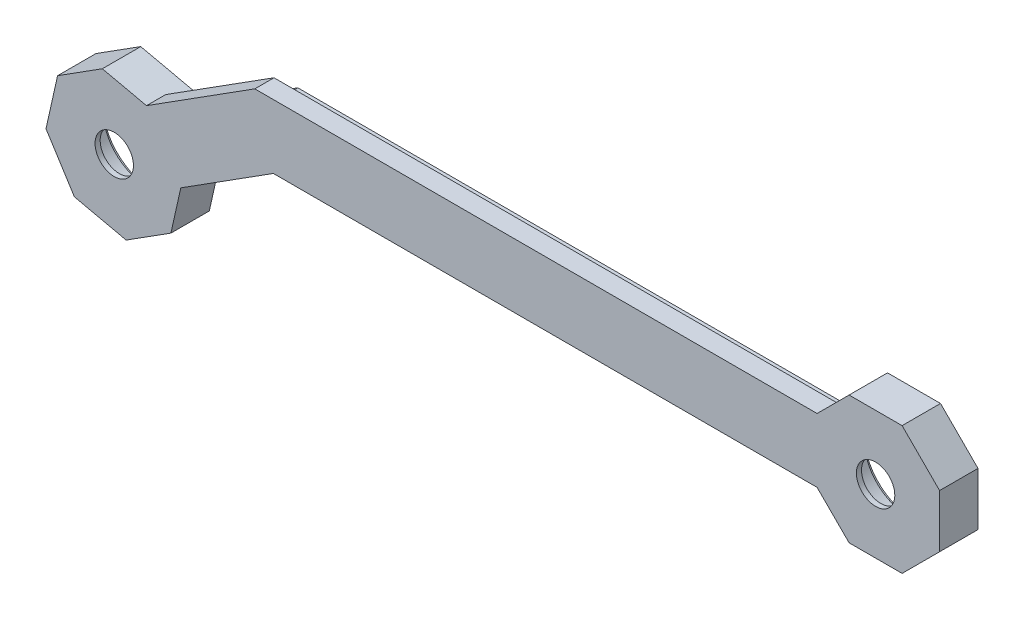
from build123d import *

# Parameters (mm, degrees)
SKETCH1_R           = 3
BOSS_EXTRUDE1_DEPTH = 6
BOSS_EXTRUDE2_DEPTH = 3
SKETCH3_R           = 7.85
CUT_EXTRUDE1_DEPTH  = 1
SKETCH4_R           = 6.75
CUT_EXTRUDE2_DEPTH  = 5.2
SKETCH5_W           = 10.298947731
SKETCH5_H           = 6.677630872
BOSS_EXTRUDE3_DEPTH = 0.8
SKETCH6_R           = 3
CUT_EXTRUDE3_DEPTH  = 0.8


with BuildPart() as part:
    # Sketch1 → Boss-Extrude1 (new body)
    with BuildSketch(Plane.XY):
        Polygon((4.142135624, 10), (-4.142135624, 10), (-11.642135624, 2.5), (-96.276080567, 2.5), (-110.474741511, -6.507268438), (-120.82549793, -4.191703376), (-127.82091412, -8.629417024), (-129.629482932, -16.713860663), (-125.191769284, -23.709276854), (-117.107325644, -25.517845665), (-110.111909454, -21.080132017), (-107.796344392, -10.729375598), (-94.823919433, -2.5), (-11.642135624, -2.5), (-4.142135624, -10), (4.142135624, -10), (10, -4.142135624), (10, 4.142135624), align=None)
        with Locations((-118.966411787, -14.85477452)):
            Circle(SKETCH1_R, mode=Mode.SUBTRACT)
        with Locations((-0.876614201, 0)):
            Circle(SKETCH1_R, mode=Mode.SUBTRACT)
    extrude(amount=-BOSS_EXTRUDE1_DEPTH)

    # Sketch2 → Boss-Extrude2 (add)
    with BuildSketch(Plane.XY):
        Polygon((-113.924993651, -5.735413417), (-110.474741511, -6.507268438), (-96.276080567, 2.5), (-11.642135624, 2.5), (-9.142135624, 5), (-97.002161134, 5), align=None)
        Polygon((-108.568199413, -14.179627738), (-107.796344392, -10.729375598), (-94.823919433, -2.5), (-11.642135624, -2.5), (-9.142135624, -5), (-94.097838866, -5), align=None)
    extrude(amount=-BOSS_EXTRUDE2_DEPTH)

    # Sketch3 → Cut-Extrude1 (cut)
    with BuildSketch(Plane(origin=(0, 0, -6), x_dir=(-1, 0, 0), z_dir=(0, 0, -1))):
        Circle(SKETCH3_R)
        with Locations((118.966411787, -14.85477452)):
            Circle(SKETCH3_R)
    extrude(amount=-CUT_EXTRUDE1_DEPTH, mode=Mode.SUBTRACT)

    # Sketch4 → Cut-Extrude2 (cut)
    with BuildSketch(Plane(origin=(0, 0, -6), x_dir=(-1, 0, 0), z_dir=(0, 0, -1))):
        Circle(SKETCH4_R)
        with Locations((118.966411787, -14.85477452)):
            Circle(SKETCH4_R)
    extrude(amount=-CUT_EXTRUDE2_DEPTH, mode=Mode.SUBTRACT)

    # Sketch5 → Boss-Extrude3 (add)
    with BuildSketch(Plane.XY):
        with Locations((-0.876614202, 0)):
            Rectangle(SKETCH5_W, SKETCH5_H)
    extrude(amount=-BOSS_EXTRUDE3_DEPTH)

    # Sketch6 → Cut-Extrude3 (cut)
    with BuildSketch(Plane.XY):
        Circle(SKETCH6_R)
    extrude(amount=-CUT_EXTRUDE3_DEPTH, mode=Mode.SUBTRACT)


solid = part.part
